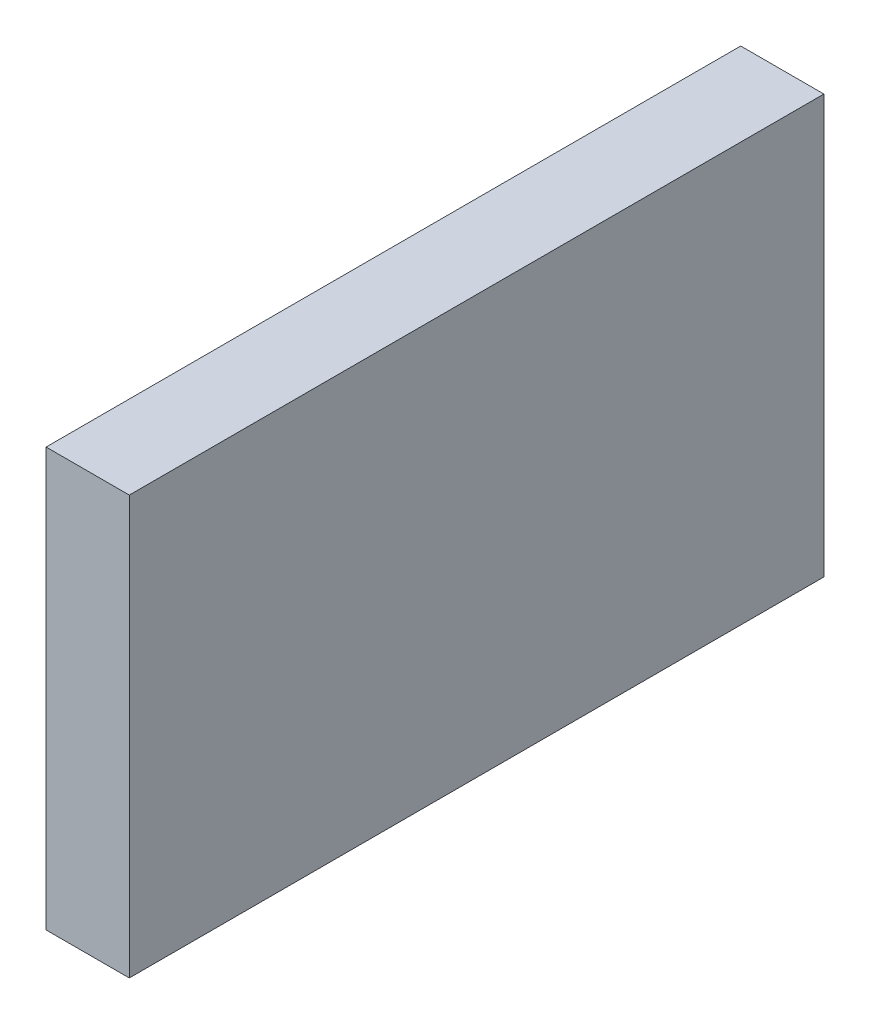
from build123d import *

# Parameters (mm, degrees)
SKETCH1_W           = 83.492924227
SKETCH1_H           = 50.273399056
BOSS_EXTRUDE1_DEPTH = 10


with BuildPart() as part:
    # Sketch1 → Boss-Extrude1 (new body)
    with BuildSketch(Plane(origin=(0, 0, 0), x_dir=(0, 0, -1), z_dir=(1, 0, 0))):
        with Locations((-13.145694453, 9.5039818)):
            Rectangle(SKETCH1_W, SKETCH1_H)
    extrude(amount=BOSS_EXTRUDE1_DEPTH)


solid = part.part
